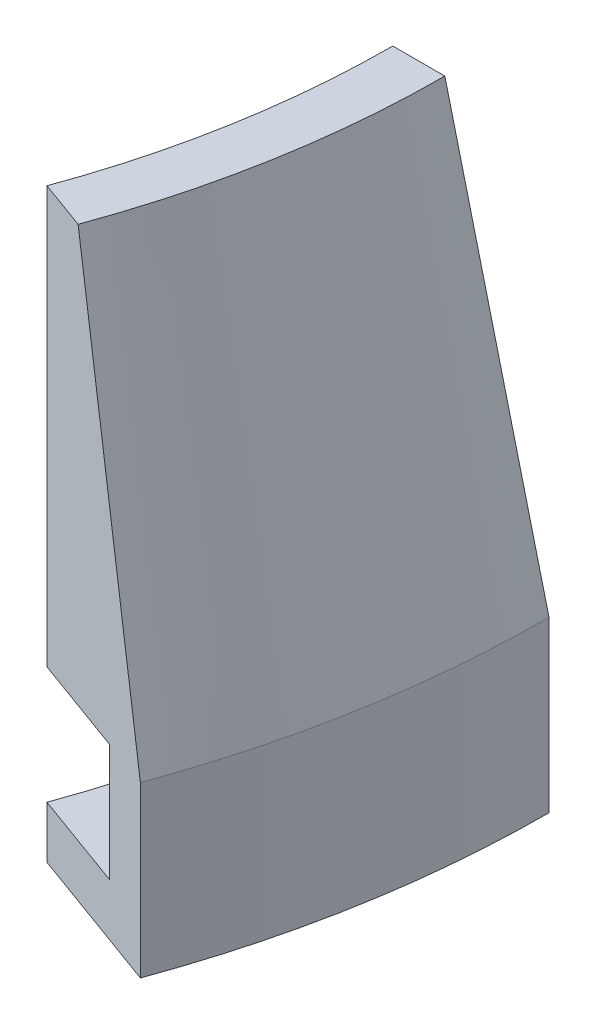
from build123d import *

# Parameters (mm, degrees)
REVOLVE1_ANGLE = 20


with BuildPart() as part:
    # Sketch1 → Revolve1 (revolve)
    with BuildSketch(Plane.XY):
        Polygon((0, 50.8), (0, 0), (12.7, 0), (12.7, -14.2875), (0, -14.2875), (0, -20.6375), (19.05, -20.6375), (19.05, 0), (6.35, 50.8), align=None)
    revolve(axis=Axis((-104.775, 37.30546868, 0), (0, -1, 0)), revolution_arc=REVOLVE1_ANGLE)


solid = part.part
